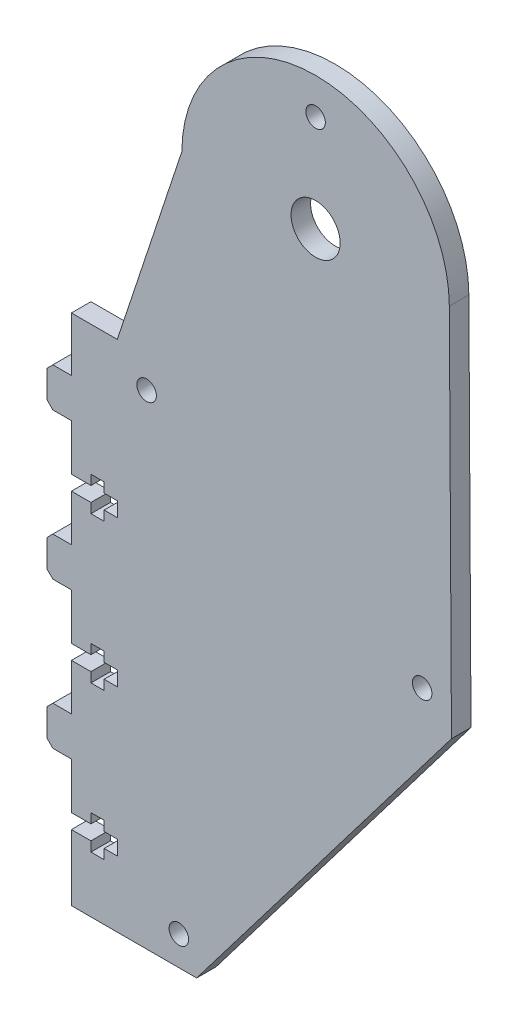
from build123d import *

# Parameters (mm, degrees)
SKETCH_1_R          = 5.03
SKETCH_1_R_2        = 2
EXTRUDE_1_DEPTH     = 4
CUT_EXTRUDE_1_DEPTH = 4


with BuildPart() as part:
    # 草图1 → 凸台-拉伸1 (new body)
    with BuildSketch(Plane.XY):
        with BuildLine():
            Line((298.551498293, -96.645689396), (302.551498293, -96.645689396))
            Line((302.551498293, -96.645689396), (302.551498293, -98.644151028))
            Line((302.551498293, -98.644151028), (305.251498293, -98.644151028))
            Line((305.251498293, -98.644151028), (305.251498293, -96.645689396))
            Line((305.251498293, -96.645689396), (307.951498293, -96.645689396))
            Line((307.951498293, -96.645689396), (307.951498293, -93.645689396))
            Line((307.951498293, -93.645689396), (305.251498293, -93.645689396))
            Line((305.251498293, -93.645689396), (305.251498293, -91.647227763))
            Line((305.251498293, -91.647227763), (302.551498293, -91.647227763))
            Line((302.551498293, -91.647227763), (302.551498293, -93.645689396))
            Line((302.551498293, -93.645689396), (298.551498293, -93.645689396))
            Line((298.551498293, -93.645689396), (298.551498293, -84.145716775))
            Line((298.551498293, -84.145716775), (293.551498293, -84.145716775))
            Line((293.551498293, -84.145716775), (293.551498293, -76.145716775))
            Line((293.551498293, -76.145716775), (298.551498293, -76.145716775))
            Line((298.551498293, -76.145716775), (298.551498293, -66.645694374))
            Line((298.551498293, -66.645694374), (302.551498293, -66.645694374))
            Line((302.551498293, -66.645694374), (302.551498293, -68.644156006))
            Line((302.551498293, -68.644156006), (305.251498293, -68.644156006))
            Line((305.251498293, -68.644156006), (305.251498293, -66.645694374))
            Line((305.251498293, -66.645694374), (307.951498293, -66.645694374))
            Line((307.951498293, -66.645694374), (307.951498293, -63.645694374))
            Line((307.951498293, -63.645694374), (305.251498293, -63.645694374))
            Line((305.251498293, -63.645694374), (305.251498293, -61.647232741))
            Line((305.251498293, -61.647232741), (302.551498293, -61.647232741))
            Line((302.551498293, -61.647232741), (302.551498293, -63.645694374))
            Line((302.551498293, -63.645694374), (298.551498293, -63.645694374))
            Line((298.551498293, -63.645694374), (298.551498293, -54.145671973))
            Line((298.551498293, -54.145671973), (293.551498293, -54.145671973))
            Line((293.551498293, -54.145671973), (293.551498293, -46.145671973))
            Line((293.551498293, -46.145671973), (298.551498293, -46.145671973))
            Line((298.551498293, -46.145671973), (298.551498293, -35.045714286))
            Line((298.551498293, -35.045714286), (307.942857143, -35.045714286))
            Line((307.942857143, -35.045714286), (321.159325739, 4.854285714))
            ThreePointArc((321.159325739, 4.854285714), (348.542857143, 32.081451417), (375.926388547, 4.854285714))
            Line((375.926388547, 4.854285714), (376.364473934, -71.645714286))
            Line((376.364473934, -71.645714286), (324.194731876, -140.145734198))
            Line((324.194731876, -140.145734198), (298.551498293, -140.145734198))
            Line((298.551498293, -140.145734198), (298.551498293, -126.645734198))
            Line((298.551498293, -126.645734198), (302.551498293, -126.645734198))
            Line((302.551498293, -126.645734198), (302.551498293, -128.644195831))
            Line((302.551498293, -128.644195831), (305.251498293, -128.644195831))
            Line((305.251498293, -128.644195831), (305.251498293, -126.645734198))
            Line((305.251498293, -126.645734198), (307.951498293, -126.645734198))
            Line((307.951498293, -126.645734198), (307.951498293, -123.645734198))
            Line((307.951498293, -123.645734198), (305.251498293, -123.645734198))
            Line((305.251498293, -123.645734198), (305.251498293, -121.647272565))
            Line((305.251498293, -121.647272565), (302.551498293, -121.647272565))
            Line((302.551498293, -121.647272565), (302.551498293, -123.645734198))
            Line((302.551498293, -123.645734198), (298.551498293, -123.645734198))
            Line((298.551498293, -123.645734198), (298.551498293, -114.145711797))
            Line((298.551498293, -114.145711797), (293.551498293, -114.145711797))
            Line((293.551498293, -114.145711797), (293.551498293, -106.145711797))
            Line((293.551498293, -106.145711797), (298.551498293, -106.145711797))
            Line((298.551498293, -106.145711797), (298.551498293, -96.645689396))
        make_face()
        with Locations((348.542857143, 4.854285714)):
            Circle(SKETCH_1_R, mode=Mode.SUBTRACT)
        with Locations((348.542857143, 24.697471009)):
            Circle(SKETCH_1_R_2, mode=Mode.SUBTRACT)
        with Locations((320.551498293, -134.145734198)):
            Circle(SKETCH_1_R_2, mode=Mode.SUBTRACT)
        with Locations((370.364473934, -65.645714286)):
            Circle(SKETCH_1_R_2, mode=Mode.SUBTRACT)
        with Locations((313.942857143, -41.045714286)):
            Circle(SKETCH_1_R_2, mode=Mode.SUBTRACT)
    extrude(amount=EXTRUDE_1_DEPTH)

    # 草图3 → 切除-拉伸1 (cut)
    with BuildSketch(Plane.XY.offset(4)):
        Polygon((293.551498293, -46.145671973), (294.751498293, -46.145671973), (293.551498293, -47.345671973), align=None)
        Polygon((294.751498293, -84.145716775), (293.551498293, -84.145716775), (293.551498293, -82.945716775), align=None)
        Polygon((293.551498293, -77.345716775), (293.551498293, -76.145716775), (294.751498293, -76.145716775), align=None)
        Polygon((294.751498293, -54.145671973), (293.551498293, -54.145671973), (293.551498293, -52.945671973), align=None)
        Polygon((293.551498293, -114.145711797), (293.551498293, -112.945711797), (294.751498293, -114.145711797), align=None)
        Polygon((293.551498293, -107.345711797), (293.551498293, -106.145711797), (294.751498293, -106.145711797), align=None)
    extrude(amount=-CUT_EXTRUDE_1_DEPTH, mode=Mode.SUBTRACT)


solid = part.part
